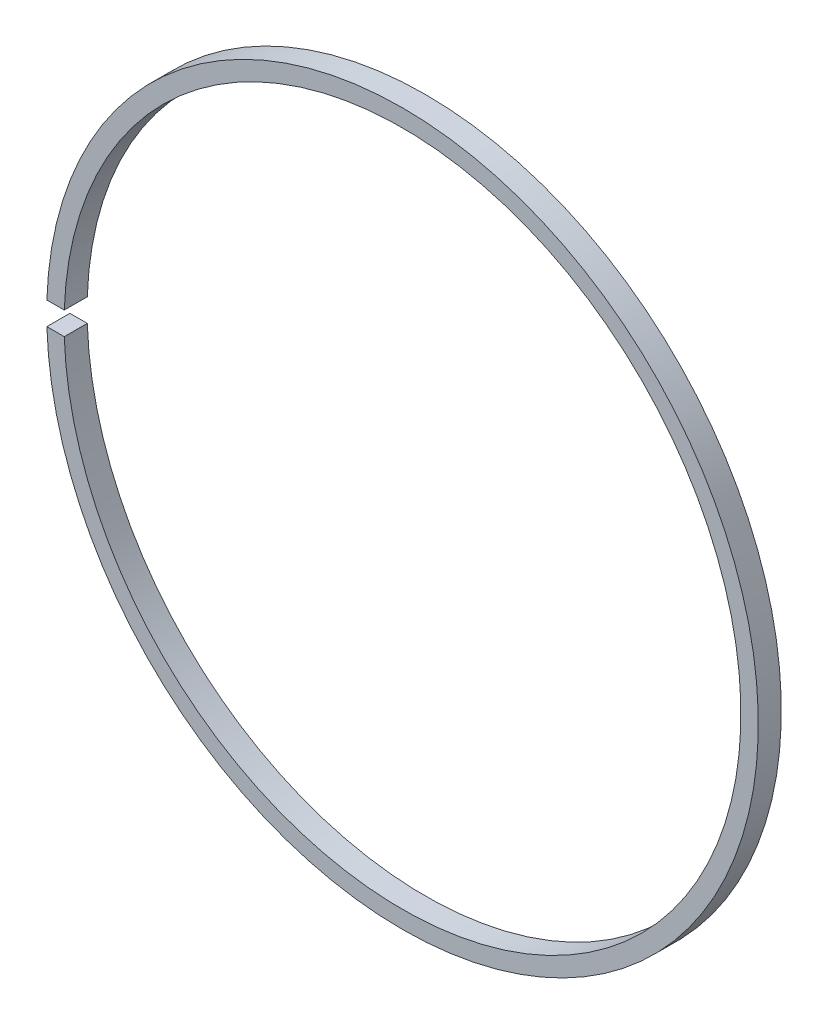
from build123d import *

# Parameters (mm, degrees)
SKETCH1_R           = 49.0855
SKETCH1_R_2         = 46.6852
BOSS_EXTRUDE1_DEPTH = 3.175
SKETCH2_W           = 50.8
SKETCH2_H           = 3.175
CUT_EXTRUDE1_DEPTH  = 70.48995068


with BuildPart() as part:
    # Sketch1 → Boss-Extrude1 (new body)
    with BuildSketch(Plane.XY):
        Circle(SKETCH1_R)
        Circle(SKETCH1_R_2, mode=Mode.SUBTRACT)
    extrude(amount=BOSS_EXTRUDE1_DEPTH)

    # Sketch2 → Cut-Extrude1 (cut, through all)
    with BuildSketch(Plane(origin=(0, 0, 0), x_dir=(-1, 0, 0), z_dir=(0, 0, -1))):
        with Locations((25.4, 0)):
            Rectangle(SKETCH2_W, SKETCH2_H)
    extrude(amount=-CUT_EXTRUDE1_DEPTH, mode=Mode.SUBTRACT)


solid = part.part
